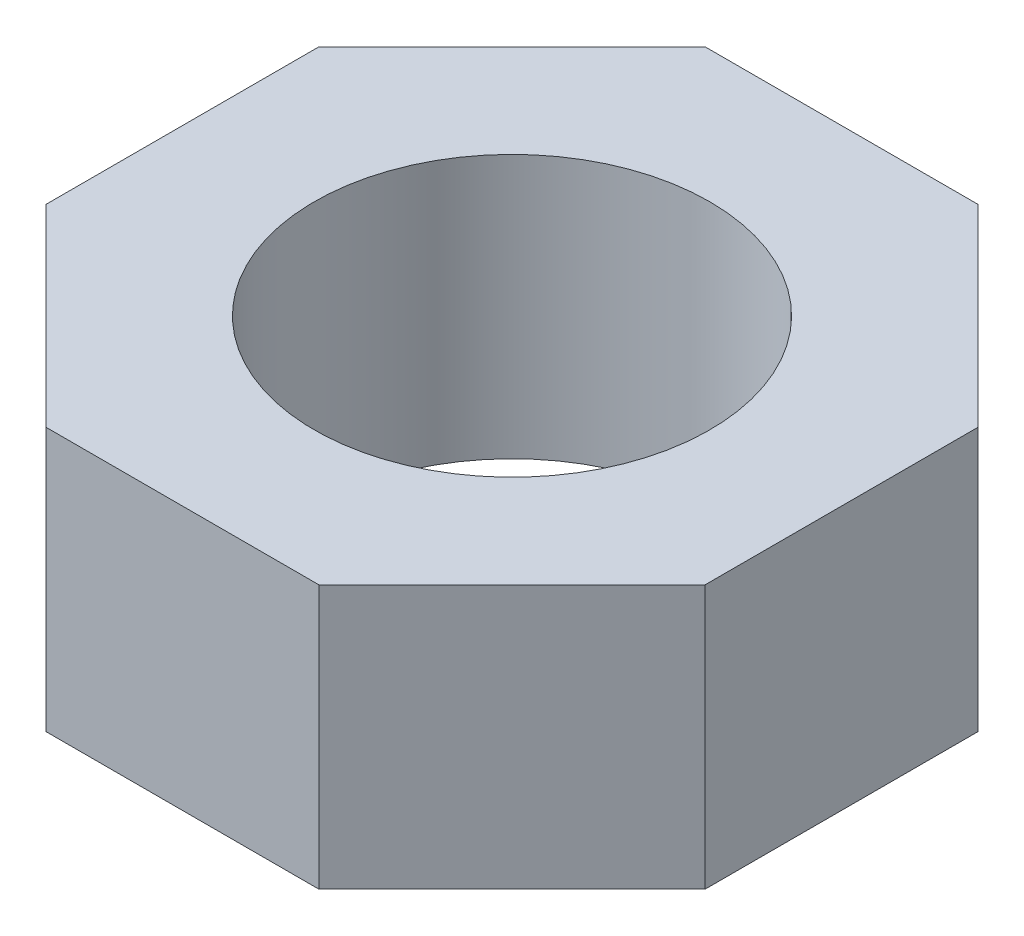
from build123d import *

# Parameters (mm, degrees)
EXTRUSION1_DEPTH        = 1
ESQUISSE3_R             = 1.5
ENL_V_MAT_EXTRU_1_DEPTH = 5.062019202


with BuildPart() as part:
    # Esquisse1 → Extrusion1 (new, symmetric)
    with BuildSketch(Plane(origin=(0, 0, 0), x_dir=(1, 0, 0), z_dir=(0, 1, 0))):
        Polygon((-1.035533906, 2.5), (1.035533906, 2.5), (2.5, 1.035533906), (2.5, -1.035533906), (1.035533906, -2.5), (-1.035533906, -2.5), (-2.5, -1.035533906), (-2.5, 1.035533906), align=None)
    extrude(amount=EXTRUSION1_DEPTH, both=True)

    # Esquisse3 → Enlèv. mat.-Extru.1 (cut, through all)
    with BuildSketch(Plane.XZ.offset(1)):
        with Locations(Location((0, 0, 0), (0, 0, 270))):
            Circle(ESQUISSE3_R)
    extrude(amount=-ENL_V_MAT_EXTRU_1_DEPTH, mode=Mode.SUBTRACT)


solid = part.part
